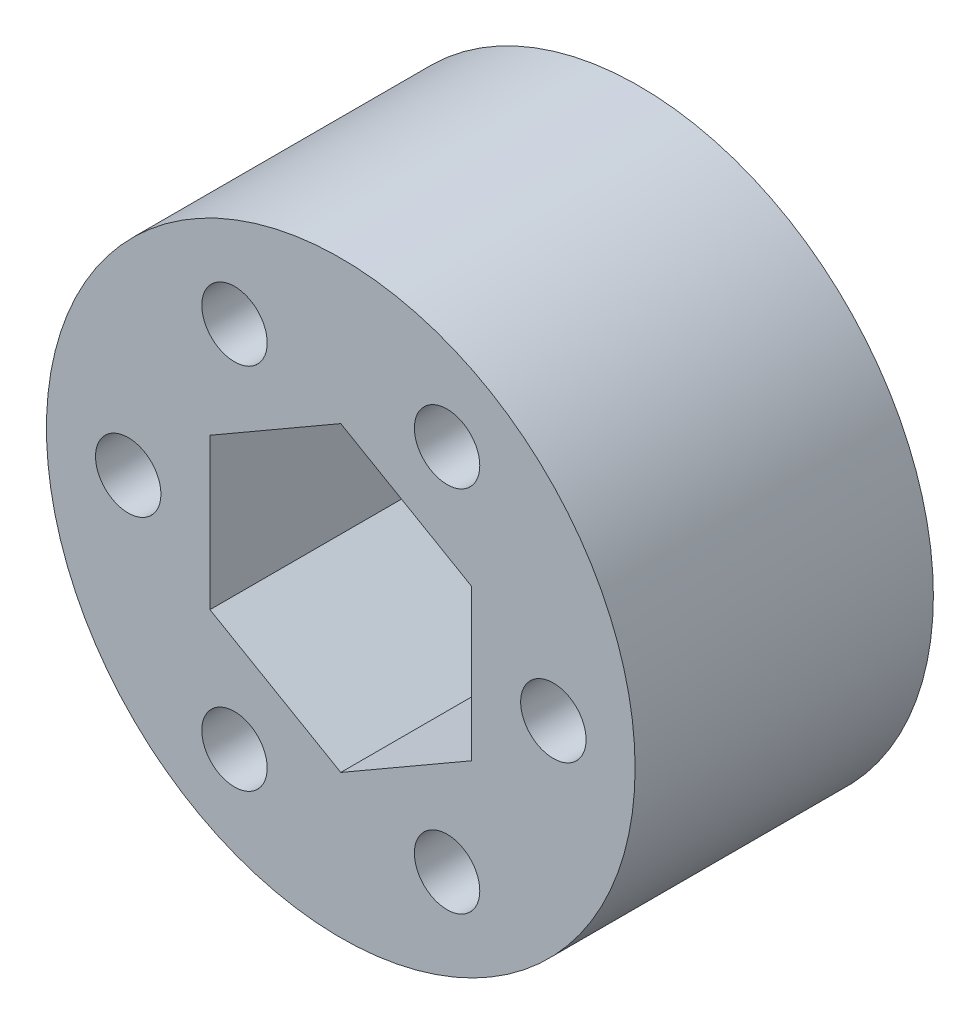
from build123d import *

# Parameters (mm, degrees)
SKETCH1_R           = 14.2875
BOSS_EXTRUDE1_DEPTH = 7.239
SKETCH2_R           = 1.5875
CUT_EXTRUDE1_DEPTH  = 25.857147795


with BuildPart() as part:
    # Sketch1 → Boss-Extrude1 (new, symmetric)
    with BuildSketch(Plane.XY):
        Circle(SKETCH1_R)
    extrude(amount=BOSS_EXTRUDE1_DEPTH, both=True)

    # Sketch2 → Cut-Extrude1 (cut, through all)
    with BuildSketch(Plane.XY.offset(7.239)):
        with Locations((-10.31875, 0)):
            Circle(SKETCH2_R)
        with Locations((-5.159375, 8.936299635)):
            Circle(SKETCH2_R)
        with Locations((5.159375, 8.936299635)):
            Circle(SKETCH2_R)
        with Locations((10.31875, 0)):
            Circle(SKETCH2_R)
        with Locations((5.159375, -8.936299635)):
            Circle(SKETCH2_R)
        with Locations((-5.159375, -8.936299635)):
            Circle(SKETCH2_R)
        Polygon((0, 7.332348419), (-6.35, 3.666174209), (-6.35, -3.666174209), (0, -7.332348419), (6.35, -3.666174209), (6.35, 3.666174209), align=None)
    extrude(amount=-CUT_EXTRUDE1_DEPTH, mode=Mode.SUBTRACT)


solid = part.part
